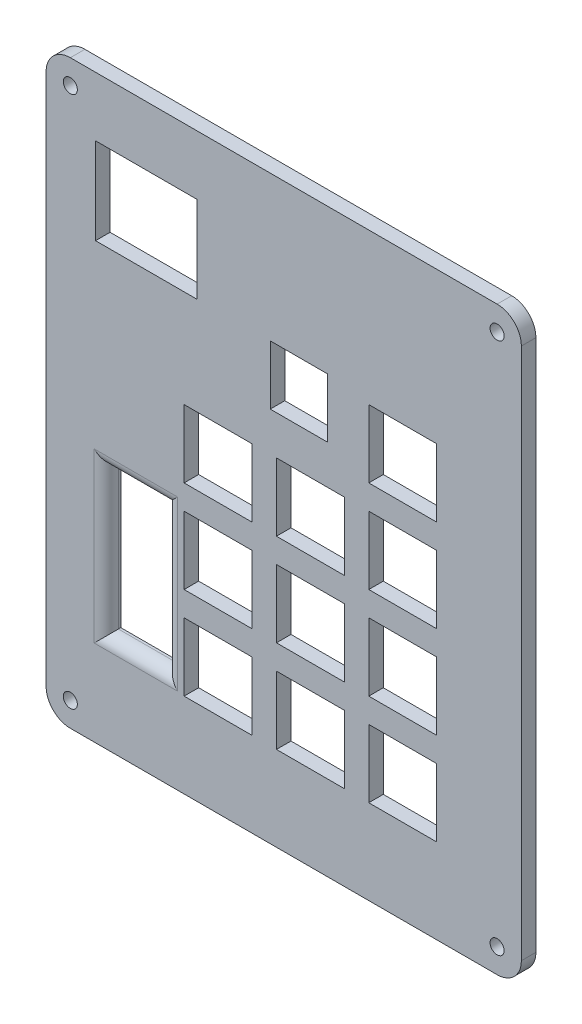
from build123d import *

# Parameters (mm, degrees)
SKETCH6_W           = 119.83
SKETCH6_H           = 98.06
SKETCH6_R           = 1.45
SKETCH6_W_2         = 12.2
SKETCH6_H_2         = 11.8
SKETCH6_W_3         = 13.99955
SKETCH6_H_3         = 13.99955
SKETCH6_W_4         = 29.7
SKETCH6_H_4         = 12.2
SKETCH6_W_5         = 17.85
SKETCH6_H_5         = 20.92
BOSS_EXTRUDE1_DEPTH = 3
FILLET1_R           = 5
FILLET2_R           = 2.5


with BuildPart() as part:
    # Sketch6 → Boss-Extrude1 (new body)
    with BuildSketch(Plane(origin=(0, 0, 0), x_dir=(0, 1, 0), z_dir=(0, 0, 1))):
        with Locations((45.049475, 34.328375)):
            Rectangle(SKETCH6_W, SKETCH6_H)
        with Locations(Location((-9.865525, 78.358375, 0), (0, 0, 270))):
            Circle(SKETCH6_R, mode=Mode.SUBTRACT)
        with Locations(Location((-9.865525, -9.701625, 0), (0, 0, 270))):
            Circle(SKETCH6_R, mode=Mode.SUBTRACT)
        with Locations(Location((99.964475, -9.701625, 0), (0, 0, 270))):
            Circle(SKETCH6_R, mode=Mode.SUBTRACT)
        with Locations(Location((99.964475, 78.358375, 0), (0, 0, 270))):
            Circle(SKETCH6_R, mode=Mode.SUBTRACT)
        with Locations((68.894475, 31.208375)):
            Rectangle(SKETCH6_W_2, SKETCH6_H_2, mode=Mode.SUBTRACT)
        with Locations((28.669475, 28.833375)):
            Rectangle(SKETCH6_W_3, SKETCH6_H_3, mode=Mode.SUBTRACT)
        with Locations((47.719475, 28.833375)):
            Rectangle(SKETCH6_W_3, SKETCH6_H_3, mode=Mode.SUBTRACT)
        with Locations((66.769475, 9.783415)):
            Rectangle(SKETCH6_W_3, SKETCH6_H_3, mode=Mode.SUBTRACT)
        with Locations((47.719475, 9.783415)):
            Rectangle(SKETCH6_W_3, SKETCH6_H_3, mode=Mode.SUBTRACT)
        with Locations((28.669475, 9.783415)):
            Rectangle(SKETCH6_W_3, SKETCH6_H_3, mode=Mode.SUBTRACT)
        with Locations((9.619425, 9.783415)):
            Rectangle(SKETCH6_W_3, SKETCH6_H_3, mode=Mode.SUBTRACT)
        with Locations((9.619425, 28.833375)):
            Rectangle(SKETCH6_W_3, SKETCH6_H_3, mode=Mode.SUBTRACT)
        with Locations((9.619425, 47.883575)):
            Rectangle(SKETCH6_W_3, SKETCH6_H_3, mode=Mode.SUBTRACT)
        with Locations((28.669475, 47.883575)):
            Rectangle(SKETCH6_W_3, SKETCH6_H_3, mode=Mode.SUBTRACT)
        with Locations((47.719475, 47.883575)):
            Rectangle(SKETCH6_W_3, SKETCH6_H_3, mode=Mode.SUBTRACT)
        with Locations((20.17965, 64.843375)):
            Rectangle(SKETCH6_W_4, SKETCH6_H_4, mode=Mode.SUBTRACT)
        with Locations((83.789475, 62.698375)):
            Rectangle(SKETCH6_W_5, SKETCH6_H_5, mode=Mode.SUBTRACT)
    extrude(amount=BOSS_EXTRUDE1_DEPTH)

    # Fillet1
    fillet1_edges = [part.edges().sort_by_distance(p)[0] for p in [
        (-83.358375, 104.964475, 1.5),
        (14.701625, 104.964475, 1.5),
        (14.701625, -14.865525, 1.5),
        (-83.358375, -14.865525, 1.5),
    ]]
    fillet(fillet1_edges, radius=FILLET1_R)

    # Fillet2
    fillet2_edges = [part.edges().sort_by_distance(p)[0] for p in [
        (-64.843375, 5.32965, 3),
        (-58.743375, 20.17965, 3),
        (-64.843375, 35.02965, 3),
        (-70.943375, 20.17965, 3),
    ]]
    fillet(fillet2_edges, radius=FILLET2_R)


solid = part.part
